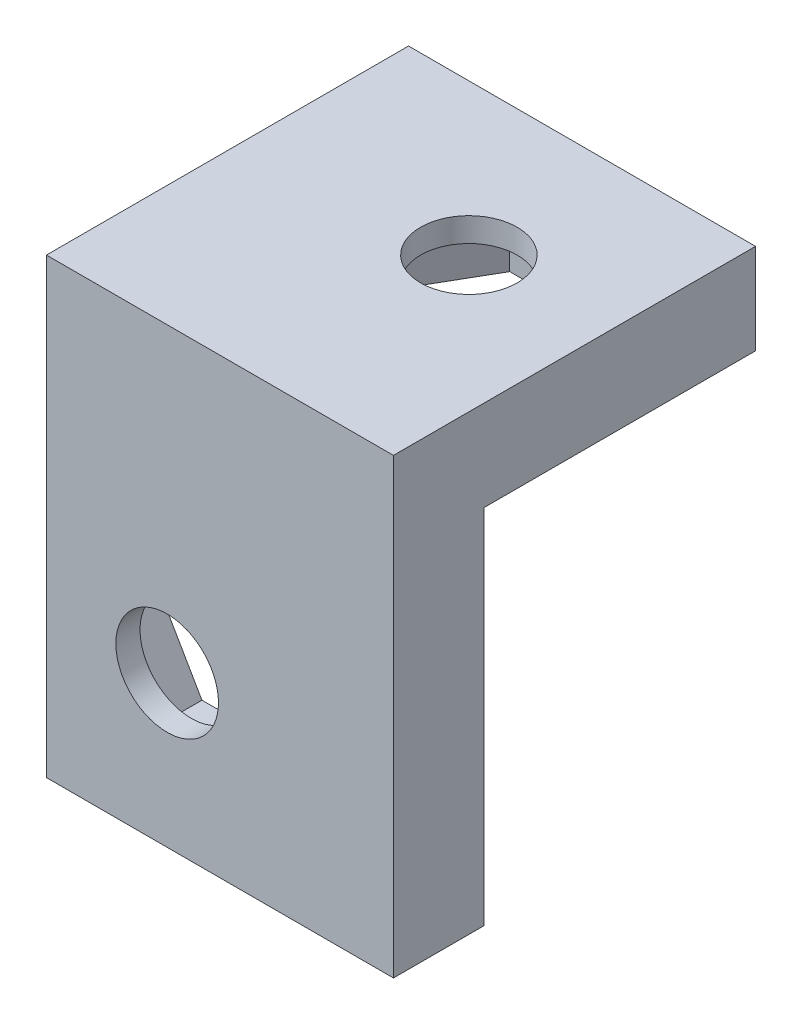
from build123d import *

# Parameters (mm, degrees)
SKETCH1_W           = 11.5
SKETCH1_H           = 12
BOSS_EXTRUDE1_DEPTH = 3
SKETCH1_4_W         = 11.5
SKETCH1_4_H         = 3
BOSS_EXTRUDE2_DEPTH = 12
SKETCH1_5_R         = 1.6
CUT_EXTRUDE1_DEPTH  = 2.2
SKETCH1_6_R         = 1.6
CUT_EXTRUDE2_DEPTH  = 21.5
SKETCH3_R           = 1.7
CUT_EXTRUDE3_DEPTH  = 2.2
SKETCH3_3_R         = 1.7
CUT_EXTRUDE4_DEPTH  = 19.901058171


with BuildPart() as part:
    # Sketch1 → Boss-Extrude1 (new body)
    with BuildSketch(Plane(origin=(0, 0, 0), x_dir=(1, 0, 0), z_dir=(0, 1, 0))):
        with Locations((5.75, 6)):
            Rectangle(SKETCH1_W, SKETCH1_H)
    extrude(amount=BOSS_EXTRUDE1_DEPTH)

    # Sketch1<4> → Boss-Extrude2 (add)
    with BuildSketch(Plane(origin=(0, 0, 0), x_dir=(1, 0, 0), z_dir=(0, 1, 0))):
        with Locations((5.75, 1.5)):
            Rectangle(SKETCH1_4_W, SKETCH1_4_H)
    extrude(amount=-BOSS_EXTRUDE2_DEPTH)

    # Sketch1<5> → Cut-Extrude1 (cut)
    with BuildSketch(Plane(origin=(0, 0, 0), x_dir=(1, 0, 0), z_dir=(0, 1, 0))):
        Polygon((5.152479139, 3.8), (8.847520861, 3.8), (10.695041723, 7), (8.847520861, 10.2), (5.152479139, 10.2), (3.304958277, 7), align=None)
        with Locations((7, 7)):
            Circle(SKETCH1_5_R, mode=Mode.SUBTRACT)
    extrude(amount=CUT_EXTRUDE1_DEPTH, mode=Mode.SUBTRACT)

    # Sketch1<6> → Cut-Extrude2 (cut, through all)
    with BuildSketch(Plane(origin=(0, 0, 0), x_dir=(1, 0, 0), z_dir=(0, 1, 0))):
        with Locations((7, 7)):
            Circle(SKETCH1_6_R)
    extrude(amount=CUT_EXTRUDE2_DEPTH, mode=Mode.SUBTRACT)

    # Sketch3 → Cut-Extrude3 (cut)
    with BuildSketch(Plane(origin=(0, 0, -3), x_dir=(-1, 0, 0), z_dir=(0, 0, -1))):
        Polygon((-5.847520861, -3.8), (-7.695041723, -7), (-5.847520861, -10.2), (-2.152479139, -10.2), (-0.304958277, -7), (-2.152479139, -3.8), align=None)
        with Locations((-4, -7)):
            Circle(SKETCH3_R, mode=Mode.SUBTRACT)
    extrude(amount=-CUT_EXTRUDE3_DEPTH, mode=Mode.SUBTRACT)

    # Sketch3<3> → Cut-Extrude4 (cut, through all)
    with BuildSketch(Plane(origin=(0, 0, -3), x_dir=(-1, 0, 0), z_dir=(0, 0, -1))):
        with Locations((-4, -7)):
            Circle(SKETCH3_3_R)
    extrude(amount=-CUT_EXTRUDE4_DEPTH, mode=Mode.SUBTRACT)


solid = part.part
